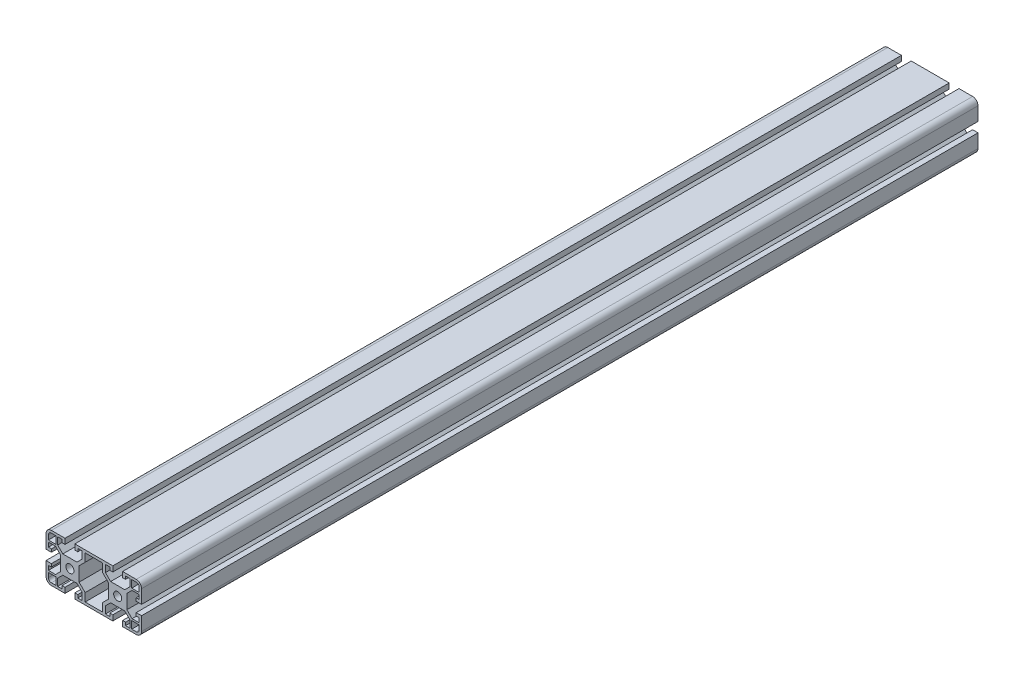
from build123d import *

# Parameters (mm, degrees)
SKETCH1_R           = 3.4
BOSS_EXTRUDE1_DEPTH = 700


with BuildPart() as part:
    # Sketch1 → Boss-Extrude1 (new body)
    with BuildSketch(Plane.XY):
        with BuildLine():
            Line((24.1, -20), (35.5, -20))
            ThreePointArc((35.5, -20), (38.681980515, -18.681980515), (40, -15.5))
            Line((40, -15.5), (40, -4.1))
            Line((40, -4.1), (35.5, -4.1))
            Line((35.5, -4.1), (35.5, -6.6))
            Line((35.5, -6.6), (38, -6.6))
            Line((38, -6.6), (38, -10.25))
            Line((38, -10.25), (32.017766953, -10.25))
            Line((32.017766953, -10.25), (27.7, -5.932233047))
            Line((27.7, -5.932233047), (27.7, 5.932233047))
            Line((27.7, 5.932233047), (32.017766953, 10.25))
            Line((32.017766953, 10.25), (38, 10.25))
            Line((38, 10.25), (38, 6.6))
            Line((38, 6.6), (35.5, 6.6))
            Line((35.5, 6.6), (35.5, 4.1))
            Line((35.5, 4.1), (40, 4.1))
            Line((40, 4.1), (40, 15.5))
            ThreePointArc((40, 15.5), (38.681980515, 18.681980515), (35.5, 20))
            Line((35.5, 20), (24.1, 20))
            Line((24.1, 20), (24.1, 15.5))
            Line((24.1, 15.5), (26.6, 15.5))
            Line((26.6, 15.5), (26.6, 18))
            Line((26.6, 18), (30.25, 18))
            Line((30.25, 18), (30.25, 12.017766953))
            Line((30.25, 12.017766953), (25.932233047, 7.7))
            Line((25.932233047, 7.7), (14.067766953, 7.7))
            Line((14.067766953, 7.7), (9.75, 12.017766953))
            Line((9.75, 12.017766953), (9.75, 18))
            Line((9.75, 18), (13.4, 18))
            Line((13.4, 18), (13.4, 15.5))
            Line((13.4, 15.5), (15.9, 15.5))
            Line((15.9, 15.5), (15.9, 20))
            Line((15.9, 20), (-15.9, 20))
            Line((-15.9, 20), (-15.9, 15.5))
            Line((-15.9, 15.5), (-13.4, 15.5))
            Line((-13.4, 15.5), (-13.4, 18))
            Line((-13.4, 18), (-9.75, 18))
            Line((-9.75, 18), (-9.75, 12.017766953))
            Line((-9.75, 12.017766953), (-14.067766953, 7.7))
            Line((-14.067766953, 7.7), (-25.932233047, 7.7))
            Line((-25.932233047, 7.7), (-30.25, 12.017766953))
            Line((-30.25, 12.017766953), (-30.25, 18))
            Line((-30.25, 18), (-26.6, 18))
            Line((-26.6, 18), (-26.6, 15.5))
            Line((-26.6, 15.5), (-24.1, 15.5))
            Line((-24.1, 15.5), (-24.1, 20))
            Line((-24.1, 20), (-35.5, 20))
            ThreePointArc((-35.5, 20), (-38.681980515, 18.681980515), (-40, 15.5))
            Line((-40, 15.5), (-40, 4.1))
            Line((-40, 4.1), (-35.5, 4.1))
            Line((-35.5, 4.1), (-35.5, 6.6))
            Line((-35.5, 6.6), (-38, 6.6))
            Line((-38, 6.6), (-38, 10.25))
            Line((-38, 10.25), (-32.017766953, 10.25))
            Line((-32.017766953, 10.25), (-27.7, 5.932233047))
            Line((-27.7, 5.932233047), (-27.7, -5.932233047))
            Line((-27.7, -5.932233047), (-32.017766953, -10.25))
            Line((-32.017766953, -10.25), (-38, -10.25))
            Line((-38, -10.25), (-38, -6.6))
            Line((-38, -6.6), (-35.5, -6.6))
            Line((-35.5, -6.6), (-35.5, -4.1))
            Line((-35.5, -4.1), (-40, -4.1))
            Line((-40, -4.1), (-40, -15.5))
            ThreePointArc((-40, -15.5), (-38.681980515, -18.681980515), (-35.5, -20))
            Line((-35.5, -20), (-24.1, -20))
            Line((-24.1, -20), (-24.1, -15.5))
            Line((-24.1, -15.5), (-26.6, -15.5))
            Line((-26.6, -15.5), (-26.6, -18))
            Line((-26.6, -18), (-30.25, -18))
            Line((-30.25, -18), (-30.25, -12.017766953))
            Line((-30.25, -12.017766953), (-25.932233047, -7.7))
            Line((-25.932233047, -7.7), (-14.067766953, -7.7))
            Line((-14.067766953, -7.7), (-9.75, -12.017766953))
            Line((-9.75, -12.017766953), (-9.75, -18))
            Line((-9.75, -18), (-13.4, -18))
            Line((-13.4, -18), (-13.4, -15.5))
            Line((-13.4, -15.5), (-15.9, -15.5))
            Line((-15.9, -15.5), (-15.9, -20))
            Line((-15.9, -20), (15.9, -20))
            Line((15.9, -20), (15.9, -15.5))
            Line((15.9, -15.5), (13.4, -15.5))
            Line((13.4, -15.5), (13.4, -18))
            Line((13.4, -18), (9.75, -18))
            Line((9.75, -18), (9.75, -12.017766953))
            Line((9.75, -12.017766953), (14.067766953, -7.7))
            Line((14.067766953, -7.7), (25.932233047, -7.7))
            Line((25.932233047, -7.7), (30.25, -12.017766953))
            Line((30.25, -12.017766953), (30.25, -18))
            Line((30.25, -18), (26.6, -18))
            Line((26.6, -18), (26.6, -15.5))
            Line((26.6, -15.5), (24.1, -15.5))
            Line((24.1, -15.5), (24.1, -20))
        make_face()
        with Locations((-20, 0)):
            Circle(SKETCH1_R, mode=Mode.SUBTRACT)
        with Locations((20, 0)):
            Circle(SKETCH1_R, mode=Mode.SUBTRACT)
        with BuildLine():
            Line((38, -15.5), (38, -11.75))
            Line((38, -11.75), (31.75, -11.75))
            Line((31.75, -11.75), (31.75, -18))
            Line((31.75, -18), (35.5, -18))
            ThreePointArc((35.5, -18), (37.267766953, -17.267766953), (38, -15.5))
        make_face(mode=Mode.SUBTRACT)
        with BuildLine():
            Line((-38, 15.5), (-38, 11.75))
            Line((-38, 11.75), (-31.75, 11.75))
            Line((-31.75, 11.75), (-31.75, 18))
            Line((-31.75, 18), (-35.5, 18))
            ThreePointArc((-35.5, 18), (-37.267766953, 17.267766953), (-38, 15.5))
        make_face(mode=Mode.SUBTRACT)
        Polygon((-7.25, -10.982233047), (-7.25, -17.8), (7.25, -17.8), (7.25, -10.982233047), (12.3, -5.932233047), (12.3, 5.932233047), (7.25, 10.982233047), (7.25, 17.8), (-7.25, 17.8), (-7.25, 10.982233047), (-12.3, 5.932233047), (-12.3, -5.932233047), align=None, mode=Mode.SUBTRACT)
        with BuildLine():
            Line((-35.5, -18), (-31.75, -18))
            Line((-31.75, -18), (-31.75, -11.75))
            Line((-31.75, -11.75), (-38, -11.75))
            Line((-38, -11.75), (-38, -15.5))
            ThreePointArc((-38, -15.5), (-37.267766953, -17.267766953), (-35.5, -18))
        make_face(mode=Mode.SUBTRACT)
        with BuildLine():
            Line((35.5, 18), (31.75, 18))
            Line((31.75, 18), (31.75, 11.75))
            Line((31.75, 11.75), (38, 11.75))
            Line((38, 11.75), (38, 15.5))
            ThreePointArc((38, 15.5), (37.267766953, 17.267766953), (35.5, 18))
        make_face(mode=Mode.SUBTRACT)
    extrude(amount=BOSS_EXTRUDE1_DEPTH)


solid = part.part
